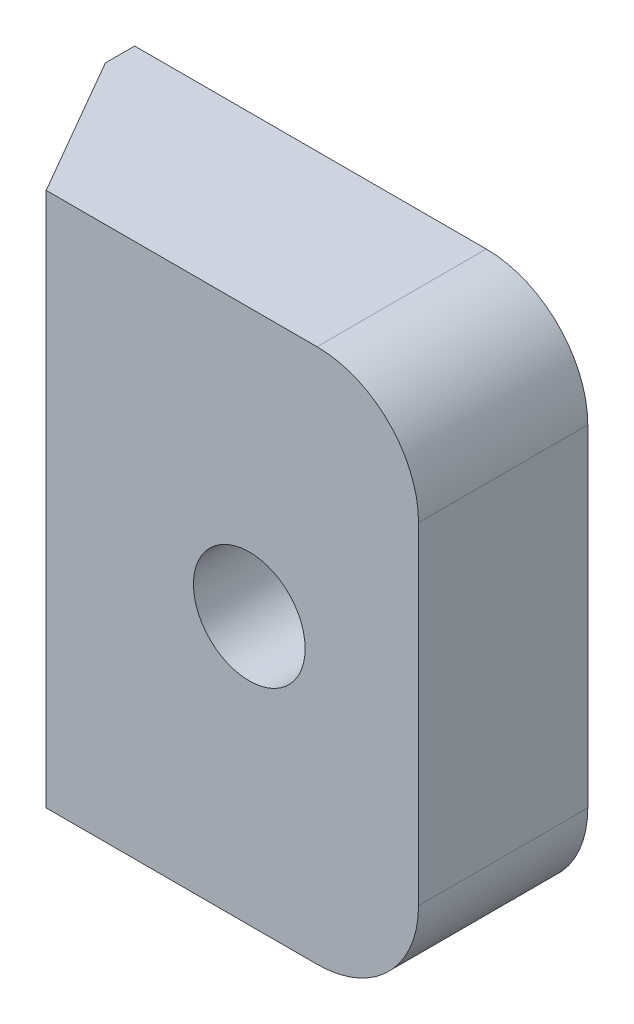
from build123d import *

# Parameters (mm, degrees)
EXTRUDE_1_DEPTH = 15.8
FILLET_1_R      = 3
M4X0_71_D       = 3.3
CHAMFER_1_SIZE  = 0.5
CHAMFER_1_SIZE2 = 1


with BuildPart() as part:
    # Эскиз1 → Бобышка-Вытянуть1 (new body)
    with BuildSketch(Plane(origin=(0, 0, 0), x_dir=(1, 0, 0), z_dir=(0, 1, 0))):
        Polygon((0, 0), (0, 5), (-13.886751346, 5), (-11, 0), align=None)
    extrude(amount=EXTRUDE_1_DEPTH)

    # Скругление1
    fillet_1_edges = [part.edges().sort_by_distance(p)[0] for p in [
        (0, 0, -2.5),
        (0, 15.8, -2.5),
    ]]
    fillet(fillet_1_edges, radius=FILLET_1_R)

    # Отверстие обработанное метчиком M4x0.71 (through all)
    with Locations(Plane.XY):
        with Locations((-5, 7.9)):
            Hole(M4X0_71_D / 2)

    # Фаска1
    chamfer_1_edges = [part.edges().sort_by_distance(p)[0] for p in [
        (-13.886751346, 7.9, -5),
    ]]
    chamfer_1_side = [part.faces().sort_by_distance(p)[0] for p in [
        (-7.140744189, 7.9, -5),
    ]]
    chamfer(chamfer_1_edges, length=CHAMFER_1_SIZE, length2=CHAMFER_1_SIZE2, reference=chamfer_1_side[0])


solid = part.part
